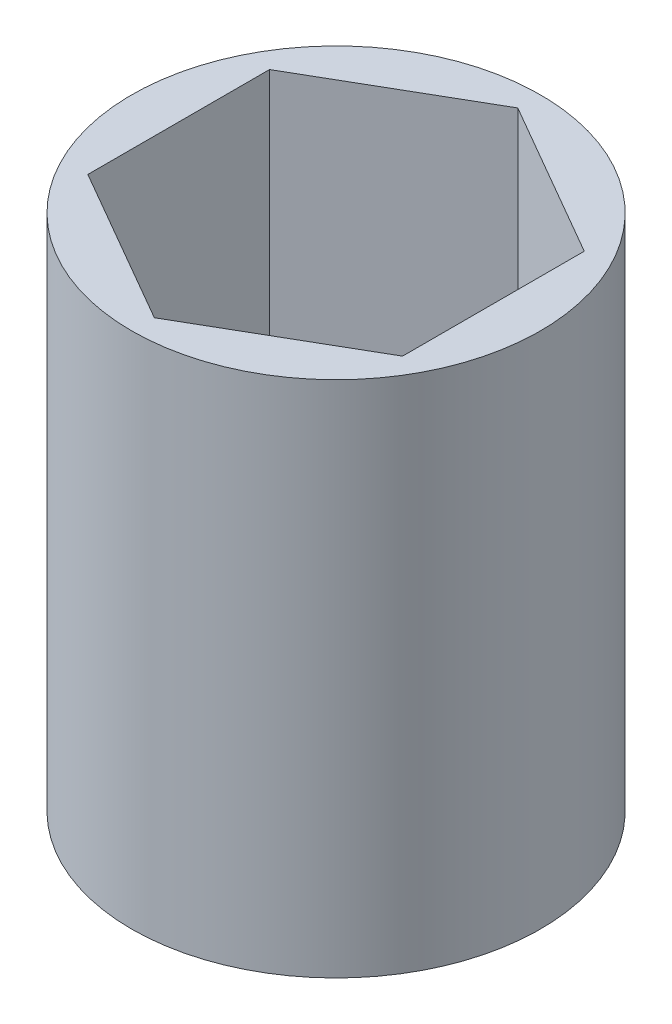
from build123d import *

# Parameters (mm, degrees)
SKETCH1_R           = 8.768816794
BOSS_EXTRUDE1_DEPTH = 22.225


with BuildPart() as part:
    # Sketch1 → Boss-Extrude1 (new body)
    with BuildSketch(Plane(origin=(0, 0, 0), x_dir=(1, 0, 0), z_dir=(0, 1, 0))):
        with Locations(Location((0, 0, 0), (0, 0, 270))):
            Circle(SKETCH1_R)
        Polygon((0, 7.794228634), (-6.75, 3.897114317), (-6.75, -3.897114317), (0, -7.794228634), (6.75, -3.897114317), (6.75, 3.897114317), align=None, mode=Mode.SUBTRACT)
    extrude(amount=BOSS_EXTRUDE1_DEPTH)


solid = part.part
